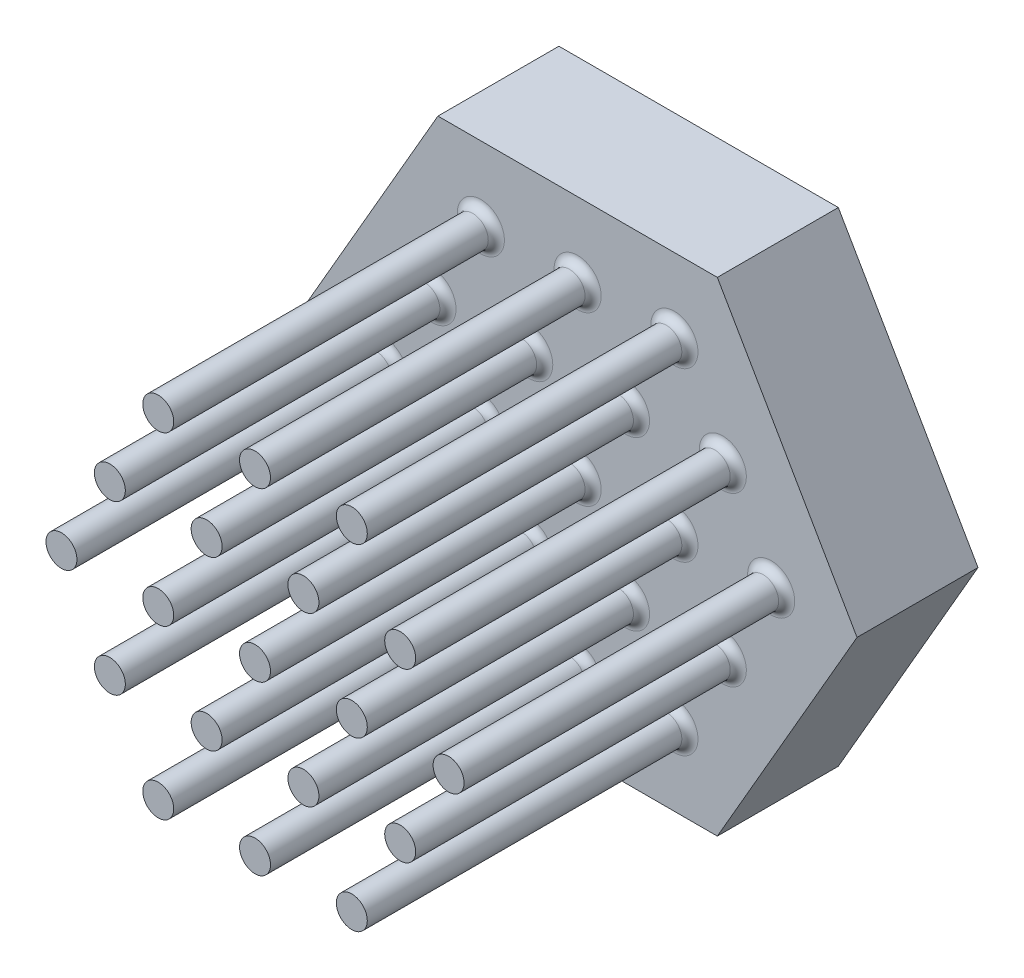
from build123d import *

# Parameters (mm, degrees)
SKETCH1_R              = 0.384
BOSS_EXTRUDE1_DEPTH    = 8
BOSS_EXTRUDE1_2_DEPTH  = 8
BOSS_EXTRUDE1_3_DEPTH  = 8
BOSS_EXTRUDE1_4_DEPTH  = 8
BOSS_EXTRUDE1_5_DEPTH  = 8
BOSS_EXTRUDE1_6_DEPTH  = 8
BOSS_EXTRUDE1_7_DEPTH  = 8
BOSS_EXTRUDE1_8_DEPTH  = 8
BOSS_EXTRUDE1_9_DEPTH  = 8
BOSS_EXTRUDE1_10_DEPTH = 8
BOSS_EXTRUDE1_11_DEPTH = 8
BOSS_EXTRUDE1_12_DEPTH = 8
BOSS_EXTRUDE1_13_DEPTH = 8
BOSS_EXTRUDE1_14_DEPTH = 8
BOSS_EXTRUDE1_15_DEPTH = 8
BOSS_EXTRUDE1_16_DEPTH = 8
BOSS_EXTRUDE1_17_DEPTH = 8
BOSS_EXTRUDE1_18_DEPTH = 8
BOSS_EXTRUDE1_19_DEPTH = 8
BOSS_EXTRUDE2_START    = -3
SKETCH1_3_R            = 0.384
BOSS_EXTRUDE2_DEPTH    = 3
FILLET1_R              = 0.2


with BuildPart() as part:
    # Sketch1 → Boss-Extrude1 (new body)
    with BuildSketch(Plane.XY):
        with Locations((4.8, 0)):
            Circle(SKETCH1_R)
    extrude(amount=BOSS_EXTRUDE1_DEPTH)



with BuildPart() as body_2:
    # Sketch1 → Boss-Extrude1 2 (new body)
    with BuildSketch(Plane.XY):
        with Locations((3.6, 2.078460969)):
            Circle(SKETCH1_R)
    extrude(amount=BOSS_EXTRUDE1_2_DEPTH)


with BuildPart() as body_3:
    # Sketch1 → Boss-Extrude1 3 (new body)
    with BuildSketch(Plane.XY):
        with Locations((2.4, 4.156921938)):
            Circle(SKETCH1_R)
    extrude(amount=BOSS_EXTRUDE1_3_DEPTH)


with BuildPart() as body_4:
    # Sketch1 → Boss-Extrude1 4 (new body)
    with BuildSketch(Plane.XY):
        with Locations((0, 4.156921938)):
            Circle(SKETCH1_R)
    extrude(amount=BOSS_EXTRUDE1_4_DEPTH)


with BuildPart() as body_5:
    # Sketch1 → Boss-Extrude1 5 (new body)
    with BuildSketch(Plane.XY):
        with Locations((-2.4, 4.156921938)):
            Circle(SKETCH1_R)
    extrude(amount=BOSS_EXTRUDE1_5_DEPTH)


with BuildPart() as body_6:
    # Sketch1 → Boss-Extrude1 6 (new body)
    with BuildSketch(Plane.XY):
        with Locations((-3.6, 2.078460969)):
            Circle(SKETCH1_R)
    extrude(amount=BOSS_EXTRUDE1_6_DEPTH)


with BuildPart() as body_7:
    # Sketch1 → Boss-Extrude1 7 (new body)
    with BuildSketch(Plane.XY):
        with Locations((-1.2, 2.078460969)):
            Circle(SKETCH1_R)
    extrude(amount=BOSS_EXTRUDE1_7_DEPTH)


with BuildPart() as body_8:
    # Sketch1 → Boss-Extrude1 8 (new body)
    with BuildSketch(Plane.XY):
        with Locations((1.2, 2.078460969)):
            Circle(SKETCH1_R)
    extrude(amount=BOSS_EXTRUDE1_8_DEPTH)


with BuildPart() as body_9:
    # Sketch1 → Boss-Extrude1 9 (new body)
    with BuildSketch(Plane.XY):
        with Locations((2.4, 0)):
            Circle(SKETCH1_R)
    extrude(amount=BOSS_EXTRUDE1_9_DEPTH)


with BuildPart() as body_10:
    # Sketch1 → Boss-Extrude1 10 (new body)
    with BuildSketch(Plane.XY):
        with Locations((3.6, -2.078460969)):
            Circle(SKETCH1_R)
    extrude(amount=BOSS_EXTRUDE1_10_DEPTH)


with BuildPart() as body_11:
    # Sketch1 → Boss-Extrude1 11 (new body)
    with BuildSketch(Plane.XY):
        with Locations((1.2, -2.078460969)):
            Circle(SKETCH1_R)
    extrude(amount=BOSS_EXTRUDE1_11_DEPTH)


with BuildPart() as body_12:
    # Sketch1 → Boss-Extrude1 12 (new body)
    with BuildSketch(Plane.XY):
        Circle(SKETCH1_R)
    extrude(amount=BOSS_EXTRUDE1_12_DEPTH)


with BuildPart() as body_13:
    # Sketch1 → Boss-Extrude1 13 (new body)
    with BuildSketch(Plane.XY):
        with Locations((-2.4, 0)):
            Circle(SKETCH1_R)
    extrude(amount=BOSS_EXTRUDE1_13_DEPTH)


with BuildPart() as body_14:
    # Sketch1 → Boss-Extrude1 14 (new body)
    with BuildSketch(Plane.XY):
        with Locations((-4.8, 0)):
            Circle(SKETCH1_R)
    extrude(amount=BOSS_EXTRUDE1_14_DEPTH)


with BuildPart() as body_15:
    # Sketch1 → Boss-Extrude1 15 (new body)
    with BuildSketch(Plane.XY):
        with Locations((-3.6, -2.078460969)):
            Circle(SKETCH1_R)
    extrude(amount=BOSS_EXTRUDE1_15_DEPTH)


with BuildPart() as body_16:
    # Sketch1 → Boss-Extrude1 16 (new body)
    with BuildSketch(Plane.XY):
        with Locations((-1.2, -2.078460969)):
            Circle(SKETCH1_R)
    extrude(amount=BOSS_EXTRUDE1_16_DEPTH)


with BuildPart() as body_17:
    # Sketch1 → Boss-Extrude1 17 (new body)
    with BuildSketch(Plane.XY):
        with Locations((2.4, -4.156921938)):
            Circle(SKETCH1_R)
    extrude(amount=BOSS_EXTRUDE1_17_DEPTH)


with BuildPart() as body_18:
    # Sketch1 → Boss-Extrude1 18 (new body)
    with BuildSketch(Plane.XY):
        with Locations((0, -4.156921938)):
            Circle(SKETCH1_R)
    extrude(amount=BOSS_EXTRUDE1_18_DEPTH)


with BuildPart() as body_19:
    # Sketch1 → Boss-Extrude1 19 (new body)
    with BuildSketch(Plane.XY):
        with Locations((-2.4, -4.156921938)):
            Circle(SKETCH1_R)
    extrude(amount=BOSS_EXTRUDE1_19_DEPTH)


with BuildPart() as part_1:
    add(part.part)

    add(body_2.part)  # Boss-Extrude2 merges body 2

    add(body_3.part)  # Boss-Extrude2 merges body 3

    add(body_4.part)  # Boss-Extrude2 merges body 4

    add(body_5.part)  # Boss-Extrude2 merges body 5

    add(body_6.part)  # Boss-Extrude2 merges body 6

    add(body_7.part)  # Boss-Extrude2 merges body 7

    add(body_8.part)  # Boss-Extrude2 merges body 8

    add(body_9.part)  # Boss-Extrude2 merges body 9

    add(body_10.part)  # Boss-Extrude2 merges body 10

    add(body_11.part)  # Boss-Extrude2 merges body 11

    add(body_12.part)  # Boss-Extrude2 merges body 12

    add(body_13.part)  # Boss-Extrude2 merges body 13

    add(body_14.part)  # Boss-Extrude2 merges body 14

    add(body_15.part)  # Boss-Extrude2 merges body 15

    add(body_16.part)  # Boss-Extrude2 merges body 16

    add(body_17.part)  # Boss-Extrude2 merges body 17

    add(body_18.part)  # Boss-Extrude2 merges body 18

    add(body_19.part)  # Boss-Extrude2 merges body 19
    # Sketch1<3> → Boss-Extrude2 (add)
    # profile 1 of 20: a face of its own
    with BuildSketch(Plane.XY.offset(BOSS_EXTRUDE2_START)):
        Polygon((-3.464101615, -6), (3.464101615, -6), (6.92820323, 0), (3.464101615, 6), (-3.464101615, 6), (-6.92820323, 0), align=None)
        with Locations((2.4, -4.156921938)):
            Circle(SKETCH1_3_R, mode=Mode.SUBTRACT)
        with Locations((0, -4.156921938)):
            Circle(SKETCH1_3_R, mode=Mode.SUBTRACT)
        with Locations((-2.4, -4.156921938)):
            Circle(SKETCH1_3_R, mode=Mode.SUBTRACT)
        with Locations((-3.6, -2.078460969)):
            Circle(SKETCH1_3_R, mode=Mode.SUBTRACT)
        with Locations((3.6, -2.078460969)):
            Circle(SKETCH1_3_R, mode=Mode.SUBTRACT)
        with Locations((1.2, -2.078460969)):
            Circle(SKETCH1_3_R, mode=Mode.SUBTRACT)
        with Locations((-1.2, -2.078460969)):
            Circle(SKETCH1_3_R, mode=Mode.SUBTRACT)
        with Locations((-2.4, 4.156921938)):
            Circle(SKETCH1_3_R, mode=Mode.SUBTRACT)
        with Locations((0, 4.156921938)):
            Circle(SKETCH1_3_R, mode=Mode.SUBTRACT)
        with Locations((2.4, 4.156921938)):
            Circle(SKETCH1_3_R, mode=Mode.SUBTRACT)
        with Locations((-3.6, 2.078460969)):
            Circle(SKETCH1_3_R, mode=Mode.SUBTRACT)
        with Locations((-1.2, 2.078460969)):
            Circle(SKETCH1_3_R, mode=Mode.SUBTRACT)
        with Locations((3.6, 2.078460969)):
            Circle(SKETCH1_3_R, mode=Mode.SUBTRACT)
        with Locations((1.2, 2.078460969)):
            Circle(SKETCH1_3_R, mode=Mode.SUBTRACT)
        with Locations((-4.8, 0)):
            Circle(SKETCH1_3_R, mode=Mode.SUBTRACT)
        with Locations((-2.4, 0)):
            Circle(SKETCH1_3_R, mode=Mode.SUBTRACT)
        with Locations((4.8, 0)):
            Circle(SKETCH1_3_R, mode=Mode.SUBTRACT)
        with Locations((2.4, 0)):
            Circle(SKETCH1_3_R, mode=Mode.SUBTRACT)
        Circle(SKETCH1_3_R, mode=Mode.SUBTRACT)
    # profile 2 of 20: a face of its own
    with BuildSketch(Plane.XY.offset(BOSS_EXTRUDE2_START)):
        with Locations((3.6, -2.078460969)):
            Circle(SKETCH1_3_R)
    # profile 3 of 20: a face of its own
    with BuildSketch(Plane.XY.offset(BOSS_EXTRUDE2_START)):
        with Locations((4.8, 0)):
            Circle(SKETCH1_3_R)
    # profile 4 of 20: a face of its own
    with BuildSketch(Plane.XY.offset(BOSS_EXTRUDE2_START)):
        with Locations((3.6, 2.078460969)):
            Circle(SKETCH1_3_R)
    # profile 5 of 20: a face of its own
    with BuildSketch(Plane.XY.offset(BOSS_EXTRUDE2_START)):
        with Locations((2.4, 4.156921938)):
            Circle(SKETCH1_3_R)
    # profile 6 of 20: a face of its own
    with BuildSketch(Plane.XY.offset(BOSS_EXTRUDE2_START)):
        with Locations((0, 4.156921938)):
            Circle(SKETCH1_3_R)
    # profile 7 of 20: a face of its own
    with BuildSketch(Plane.XY.offset(BOSS_EXTRUDE2_START)):
        with Locations((2.4, 0)):
            Circle(SKETCH1_3_R)
    # profile 8 of 20: a face of its own
    with BuildSketch(Plane.XY.offset(BOSS_EXTRUDE2_START)):
        with Locations((1.2, 2.078460969)):
            Circle(SKETCH1_3_R)
    # profile 9 of 20: a face of its own
    with BuildSketch(Plane.XY.offset(BOSS_EXTRUDE2_START)):
        with Locations((2.4, -4.156921938)):
            Circle(SKETCH1_3_R)
    # profile 10 of 20: a face of its own
    with BuildSketch(Plane.XY.offset(BOSS_EXTRUDE2_START)):
        with Locations((1.2, -2.078460969)):
            Circle(SKETCH1_3_R)
    # profile 11 of 20: a face of its own
    with BuildSketch(Plane.XY.offset(BOSS_EXTRUDE2_START)):
        Circle(SKETCH1_3_R)
    # profile 12 of 20: a face of its own
    with BuildSketch(Plane.XY.offset(BOSS_EXTRUDE2_START)):
        with Locations((-1.2, 2.078460969)):
            Circle(SKETCH1_3_R)
    # profile 13 of 20: a face of its own
    with BuildSketch(Plane.XY.offset(BOSS_EXTRUDE2_START)):
        with Locations((-2.4, 4.156921938)):
            Circle(SKETCH1_3_R)
    # profile 14 of 20: a face of its own
    with BuildSketch(Plane.XY.offset(BOSS_EXTRUDE2_START)):
        with Locations((-3.6, 2.078460969)):
            Circle(SKETCH1_3_R)
    # profile 15 of 20: a face of its own
    with BuildSketch(Plane.XY.offset(BOSS_EXTRUDE2_START)):
        with Locations((-2.4, 0)):
            Circle(SKETCH1_3_R)
    # profile 16 of 20: a face of its own
    with BuildSketch(Plane.XY.offset(BOSS_EXTRUDE2_START)):
        with Locations((-1.2, -2.078460969)):
            Circle(SKETCH1_3_R)
    # profile 17 of 20: a face of its own
    with BuildSketch(Plane.XY.offset(BOSS_EXTRUDE2_START)):
        with Locations((0, -4.156921938)):
            Circle(SKETCH1_3_R)
    # profile 18 of 20: a face of its own
    with BuildSketch(Plane.XY.offset(BOSS_EXTRUDE2_START)):
        with Locations((-2.4, -4.156921938)):
            Circle(SKETCH1_3_R)
    # profile 19 of 20: a face of its own
    with BuildSketch(Plane.XY.offset(BOSS_EXTRUDE2_START)):
        with Locations((-3.6, -2.078460969)):
            Circle(SKETCH1_3_R)
    # profile 20 of 20: a face of its own
    with BuildSketch(Plane.XY.offset(BOSS_EXTRUDE2_START)):
        with Locations((-4.8, 0)):
            Circle(SKETCH1_3_R)
    extrude(amount=BOSS_EXTRUDE2_DEPTH)

    # Fillet1
    fillet1_edges = [part_1.edges().sort_by_distance(p)[0] for p in [
        (3.216, 2.078460969, 0),
        (2.016, 4.156921938, 0),
        (-0.384, 4.156921938, 0),
        (-2.784, 4.156921938, 0),
        (-3.984, 2.078460969, 0),
        (-1.584, 2.078460969, 0),
        (0.816, 2.078460969, 0),
        (2.016, 0, 0),
        (3.216, -2.078460969, 0),
        (0.816, -2.078460969, 0),
        (-0.384, 0, 0),
        (-2.784, 0, 0),
        (-5.184, 0, 0),
        (-3.984, -2.078460969, 0),
        (4.416, 0, 0),
        (-1.584, -2.078460969, 0),
        (2.016, -4.156921938, 0),
        (-0.384, -4.156921938, 0),
        (-2.784, -4.156921938, 0),
    ]]
    fillet(fillet1_edges, radius=FILLET1_R)


solid = part_1.part
